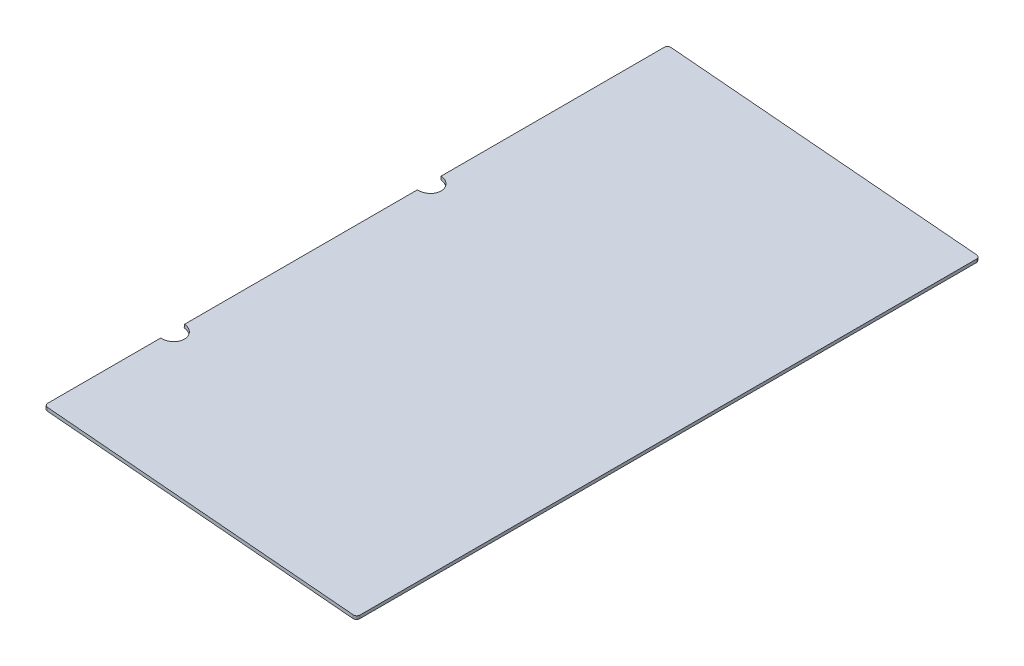
from build123d import *

# Parameters (mm, degrees)
BOSS_EXTRUDE1_DEPTH = 1168.4
SKETCH4_R           = 22.225
CUT_EXTRUDE1_DEPTH  = 1317.03899609
FILLET1_R           = 6.35


with BuildPart() as part:
    # Sketch1 → Boss-Extrude1 (new body)
    with BuildSketch(Plane.XY):
        Polygon((22.225, 51.193319499), (607.367319431, 0), (607.920758397, 6.325836333), (22.778438966, 57.519155832), align=None)
    extrude(amount=BOSS_EXTRUDE1_DEPTH)

    # Sketch4 → Cut-Extrude1 (cut, through all)
    with BuildSketch(Plane(origin=(5.167076131, 59.05995043, 0), x_dir=(0.9961946980917453, -0.08715574274766139, 0), z_dir=(0.08715574274766137, 0.9961946980917452, 0))):
        with Locations((17.67863538, -446.88125)):
            Circle(SKETCH4_R)
        with Locations((17.67863538, -927.89375)):
            Circle(SKETCH4_R)
    extrude(amount=-CUT_EXTRUDE1_DEPTH, mode=Mode.SUBTRACT)

    # Fillet1
    fillet1_edges = [part.edges().sort_by_distance(p)[0] for p in [
        (607.644038914, 3.162918166, 1168.4),
        (22.501719483, 54.356237666, 1168.4),
        (607.644038914, 3.162918166, 0),
        (22.501719483, 54.356237666, 0),
    ]]
    fillet(fillet1_edges, radius=FILLET1_R)


solid = part.part
